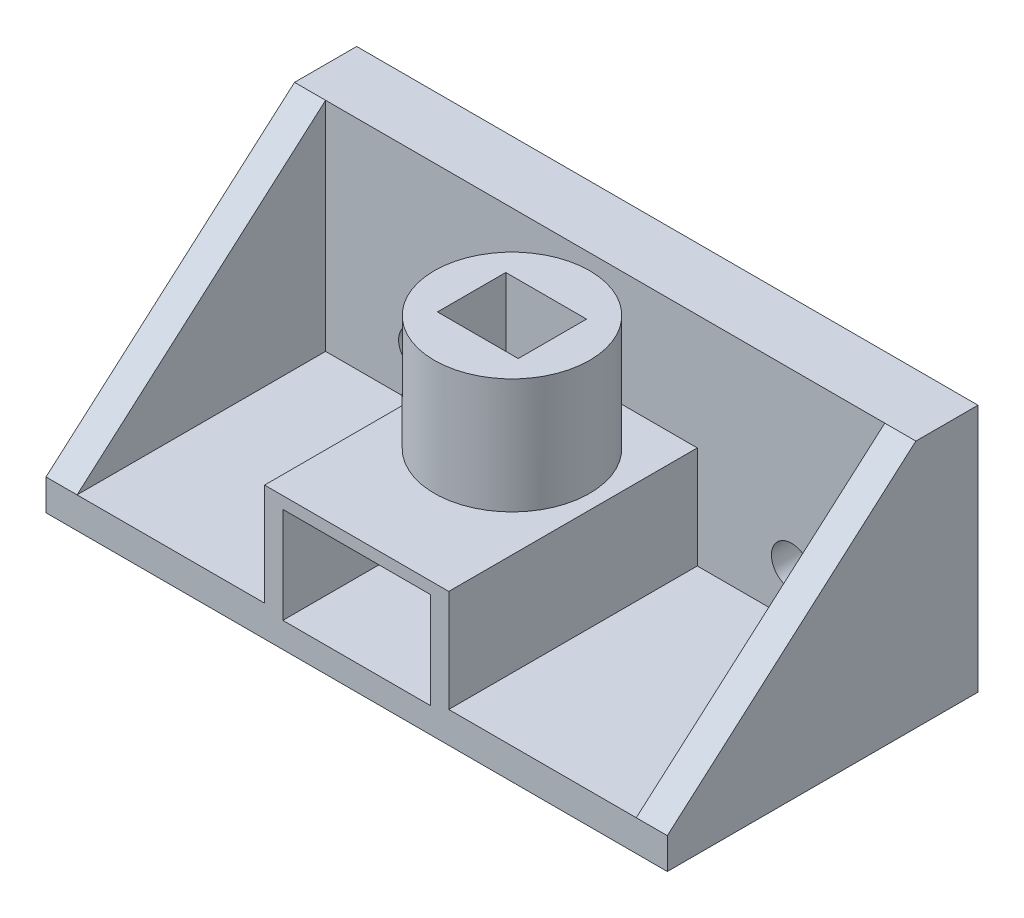
from build123d import *

# Parameters (mm, degrees)
SKETCH1_W               = 100
SKETCH1_H               = 40
SKETCH1_R               = 7.6
BOSS_EXTRUDE4_DEPTH     = 5
SKETCH9_R               = 12.5
BOSS_EXTRUDE7_DEPTH     = 35
SKETCH1_7_W             = 100
SKETCH1_7_H             = 10
EXTRUDE_THIN1_DEPTH     = 40
BOSS_EXTRUDE5_DEPTH     = 5
BOSS_EXTRUDE6_DEPTH     = 5
SKETCH11_W              = 13
SKETCH11_H              = 11
CUT_EXTRUDE2_DEPTH      = 15
SKETCH13_5_R            = 3.25
CUT_EXTRUDE4_DEPTH      = 205
SKETCH13_R              = 3.25
CUT_EXTRUDE5_DEPTH      = 205
SKETCH15_W              = 29.641034448
SKETCH15_H              = 19.301138711
SKETCH15_W_2            = 23.765799192
SKETCH15_H_2            = 15.475404125
BOSS_EXTRUDE11_DEPTH    = 50
CUT_EXTRUDE6_DEPTH      = 32
CUT_EXTRUDE6_DEPTH_BACK = 66
SKETCH16_W              = 23.765799192
SKETCH16_H              = 15.475404125
SKETCH1_11_R            = 7.6
CUT_EXTRUDE1_DEPTH      = 25


with BuildPart() as part:
    # Sketch1 → Boss-Extrude4 (new body)
    with BuildSketch(Plane(origin=(0, 0, 0), x_dir=(1, 0, 0), z_dir=(0, 1, 0))):
        with Locations((0, -5)):
            Rectangle(SKETCH1_W, SKETCH1_H)
        Circle(SKETCH1_R, mode=Mode.SUBTRACT)
    extrude(amount=BOSS_EXTRUDE4_DEPTH)

    # Sketch9 → Boss-Extrude7 (add)
    with BuildSketch(Plane(origin=(0, 5, 0), x_dir=(1, 0, 0), z_dir=(0, 1, 0))):
        Circle(SKETCH9_R)
    extrude(amount=BOSS_EXTRUDE7_DEPTH)

    # Sketch1<7> → Extrude-Thin1 (add)
    with BuildSketch(Plane(origin=(0, 0, 0), x_dir=(1, 0, 0), z_dir=(0, 1, 0))):
        with Locations((0, 20)):
            Rectangle(SKETCH1_7_W, SKETCH1_7_H)
    extrude(amount=EXTRUDE_THIN1_DEPTH)

    # Sketch5 → Boss-Extrude5 (add)
    with BuildSketch(Plane(origin=(50, 0, 0), x_dir=(0, 0, -1), z_dir=(1, 0, 0))):
        Polygon((15, 40), (15, 5), (-25, 5), align=None)
    extrude(amount=-BOSS_EXTRUDE5_DEPTH)

    # Sketch6 → Boss-Extrude6 (add)
    with BuildSketch(Plane.ZY.offset(50)):
        Polygon((-15, 40), (-15, 5), (25, 5), align=None)
    extrude(amount=-BOSS_EXTRUDE6_DEPTH)

    # Sketch11 → Cut-Extrude2 (cut)
    with BuildSketch(Plane(origin=(0, 40, 0), x_dir=(1, 0, 0), z_dir=(0, 1, 0))):
        Rectangle(SKETCH11_W, SKETCH11_H)
    extrude(amount=-CUT_EXTRUDE2_DEPTH, mode=Mode.SUBTRACT)

    # Sketch13<5> → Cut-Extrude4 (cut)
    with BuildSketch(Plane(origin=(0, 0, -25), x_dir=(-1, 0, 0), z_dir=(0, 0, -1))):
        with Locations((30, 12.5)):
            Circle(SKETCH13_5_R)
    extrude(amount=-CUT_EXTRUDE4_DEPTH, mode=Mode.SUBTRACT)

    # Sketch13 → Cut-Extrude5 (cut)
    with BuildSketch(Plane(origin=(0, 0, -25), x_dir=(-1, 0, 0), z_dir=(0, 0, -1))):
        with Locations((-30, 12.5)):
            Circle(SKETCH13_R)
    extrude(amount=-CUT_EXTRUDE5_DEPTH, mode=Mode.SUBTRACT)

    # Sketch15 → Boss-Extrude11 (add)
    with BuildSketch(Plane(origin=(0, 0, -25), x_dir=(-1, 0, 0), z_dir=(0, 0, -1))):
        with Locations((0, 11.804714301)):
            Rectangle(SKETCH15_W, SKETCH15_H)
        with Locations((0, 11.804714301)):
            Rectangle(SKETCH15_W_2, SKETCH15_H_2, mode=Mode.SUBTRACT)
    extrude(amount=-BOSS_EXTRUDE11_DEPTH)

    # Sketch16 → Cut-Extrude6 (cut, two sides: drawn at the far end of the back side and taken through both)
    with BuildSketch(Plane(origin=(0, 0, -25), x_dir=(-1, 0, 0), z_dir=(0, 0, -1)).offset(-CUT_EXTRUDE6_DEPTH_BACK)):
        with Locations((0, 11.804714301)):
            Rectangle(SKETCH16_W, SKETCH16_H)
    extrude(amount=CUT_EXTRUDE6_DEPTH + CUT_EXTRUDE6_DEPTH_BACK, mode=Mode.SUBTRACT)

    # Sketch1<11> → Cut-Extrude1 (cut)
    with BuildSketch(Plane(origin=(0, 0, 0), x_dir=(1, 0, 0), z_dir=(0, 1, 0))):
        Circle(SKETCH1_11_R)
    extrude(amount=CUT_EXTRUDE1_DEPTH, mode=Mode.SUBTRACT)


solid = part.part
